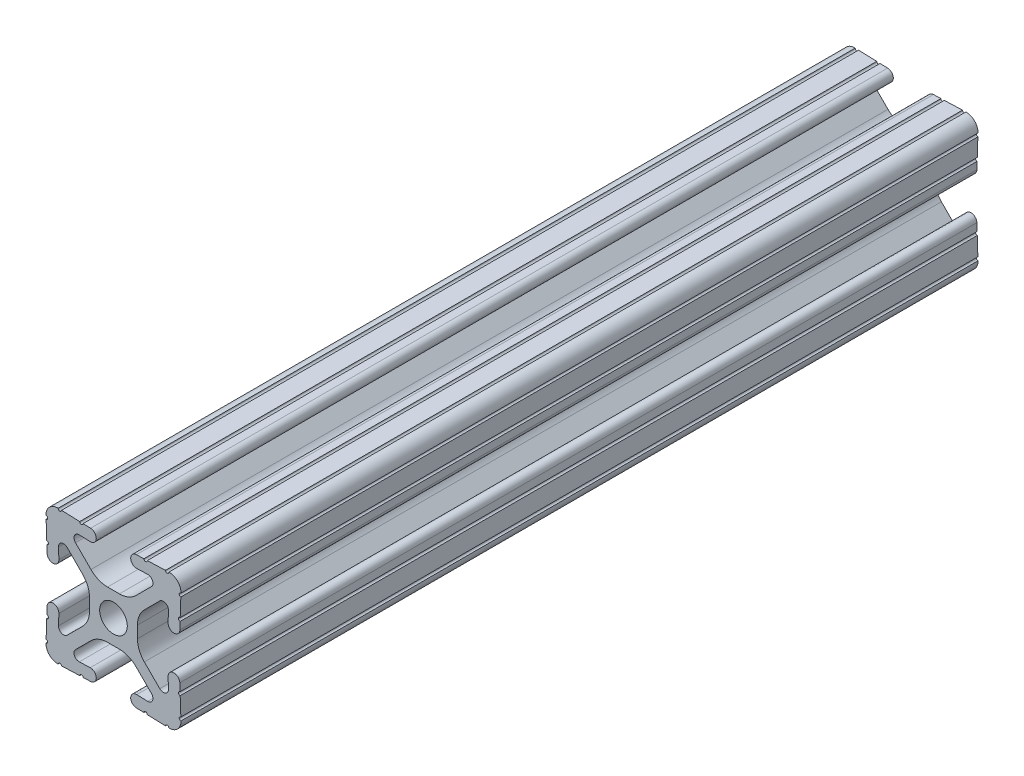
from build123d import *

# Parameters (mm, degrees)
SKETCH3_R      = 2.6035
EXTRUDE1_DEPTH = 75


with BuildPart() as part:
    # Sketch3 → Extrude1 (new, symmetric)
    with BuildSketch(Plane.XY):
        with BuildLine():
            Line((-1.115277175, 4.5085), (1.115277175, 4.5085))
            ThreePointArc((1.115277175, 4.5085), (2.806584872, 4.844922018), (4.240406305, 5.80297087))
            Line((4.240406305, 5.80297087), (7.148423664, 8.710988229))
            ThreePointArc((7.148423664, 8.710988229), (7.349906316, 9.772227925), (6.436353897, 10.348636575))
            Line((6.436353897, 10.348636575), (4.381960454, 10.276895575))
            ThreePointArc((4.381960454, 10.276895575), (3.239173075, 11.342562046), (4.304839546, 12.485349424))
            Line((4.304839546, 12.485349424), (5.728246175, 12.535055879))
            ThreePointArc((5.728246175, 12.535055879), (6.054756855, 12.230579745), (6.35923299, 12.557090424))
            Line((6.35923299, 12.557090424), (9.782092278, 12.676619304))
            ThreePointArc((9.782092278, 12.676619304), (10.108602958, 12.37214317), (10.413079092, 12.69865385))
            ThreePointArc((10.413079092, 12.69865385), (12.052764565, 12.052764565), (12.69865385, 10.413079092))
            ThreePointArc((12.69865385, 10.413079092), (12.37214317, 10.108602958), (12.676619304, 9.782092278))
            Line((12.676619304, 9.782092278), (12.557090424, 6.35923299))
            ThreePointArc((12.557090424, 6.35923299), (12.230579745, 6.054756855), (12.535055879, 5.728246175))
            Line((12.535055879, 5.728246175), (12.485349424, 4.304839546))
            ThreePointArc((12.485349424, 4.304839546), (11.342562046, 3.239173075), (10.276895575, 4.381960454))
            Line((10.276895575, 4.381960454), (10.348636575, 6.436353897))
            ThreePointArc((10.348636575, 6.436353897), (9.772227925, 7.349906316), (8.710988229, 7.148423664))
            Line((8.710988229, 7.148423664), (5.80297087, 4.240406305))
            ThreePointArc((5.80297087, 4.240406305), (4.844922018, 2.806584872), (4.5085, 1.115277175))
            Line((4.5085, 1.115277175), (4.5085, -1.115277175))
            ThreePointArc((4.5085, -1.115277175), (4.844922018, -2.806584872), (5.80297087, -4.240406305))
            Line((5.80297087, -4.240406305), (8.710988229, -7.148423664))
            ThreePointArc((8.710988229, -7.148423664), (9.772227925, -7.349906316), (10.348636575, -6.436353897))
            Line((10.348636575, -6.436353897), (10.276895575, -4.381960454))
            ThreePointArc((10.276895575, -4.381960454), (11.342562046, -3.239173075), (12.485349424, -4.304839546))
            Line((12.485349424, -4.304839546), (12.535055879, -5.728246175))
            ThreePointArc((12.535055879, -5.728246175), (12.230579745, -6.054756855), (12.557090424, -6.35923299))
            Line((12.557090424, -6.35923299), (12.676619304, -9.782092278))
            ThreePointArc((12.676619304, -9.782092278), (12.37214317, -10.108602958), (12.69865385, -10.413079092))
            ThreePointArc((12.69865385, -10.413079092), (12.052764565, -12.052764565), (10.413079092, -12.69865385))
            ThreePointArc((10.413079092, -12.69865385), (10.108602958, -12.37214317), (9.782092278, -12.676619304))
            Line((9.782092278, -12.676619304), (6.35923299, -12.557090424))
            ThreePointArc((6.35923299, -12.557090424), (6.054756855, -12.230579745), (5.728246175, -12.535055879))
            Line((5.728246175, -12.535055879), (4.304839546, -12.485349424))
            ThreePointArc((4.304839546, -12.485349424), (3.239173075, -11.342562046), (4.381960454, -10.276895575))
            Line((4.381960454, -10.276895575), (6.436353897, -10.348636575))
            ThreePointArc((6.436353897, -10.348636575), (7.349906316, -9.772227925), (7.148423664, -8.710988229))
            Line((7.148423664, -8.710988229), (4.240406305, -5.80297087))
            ThreePointArc((4.240406305, -5.80297087), (2.806584872, -4.844922018), (1.115277175, -4.5085))
            Line((1.115277175, -4.5085), (-1.115277175, -4.5085))
            ThreePointArc((-1.115277175, -4.5085), (-2.806584872, -4.844922018), (-4.240406305, -5.80297087))
            Line((-4.240406305, -5.80297087), (-7.148423664, -8.710988229))
            ThreePointArc((-7.148423664, -8.710988229), (-7.349906316, -9.772227925), (-6.436353897, -10.348636575))
            Line((-6.436353897, -10.348636575), (-4.381960454, -10.276895575))
            ThreePointArc((-4.381960454, -10.276895575), (-3.239173075, -11.342562046), (-4.304839546, -12.485349424))
            Line((-4.304839546, -12.485349424), (-5.728246175, -12.535055879))
            ThreePointArc((-5.728246175, -12.535055879), (-6.054756855, -12.230579745), (-6.35923299, -12.557090424))
            Line((-6.35923299, -12.557090424), (-9.782092278, -12.676619304))
            ThreePointArc((-9.782092278, -12.676619304), (-10.108602958, -12.37214317), (-10.413079092, -12.69865385))
            ThreePointArc((-10.413079092, -12.69865385), (-12.052764565, -12.052764565), (-12.69865385, -10.413079092))
            ThreePointArc((-12.69865385, -10.413079092), (-12.37214317, -10.108602958), (-12.676619304, -9.782092278))
            Line((-12.676619304, -9.782092278), (-12.557090424, -6.35923299))
            ThreePointArc((-12.557090424, -6.35923299), (-12.230579745, -6.054756855), (-12.535055879, -5.728246175))
            Line((-12.535055879, -5.728246175), (-12.485349424, -4.304839546))
            ThreePointArc((-12.485349424, -4.304839546), (-11.342562046, -3.239173075), (-10.276895575, -4.381960454))
            Line((-10.276895575, -4.381960454), (-10.348636575, -6.436353897))
            ThreePointArc((-10.348636575, -6.436353897), (-9.772227925, -7.349906316), (-8.710988229, -7.148423664))
            Line((-8.710988229, -7.148423664), (-5.80297087, -4.240406305))
            ThreePointArc((-5.80297087, -4.240406305), (-4.844922018, -2.806584872), (-4.5085, -1.115277175))
            Line((-4.5085, -1.115277175), (-4.5085, 1.115277175))
            ThreePointArc((-4.5085, 1.115277175), (-4.844922018, 2.806584872), (-5.80297087, 4.240406305))
            Line((-5.80297087, 4.240406305), (-8.710988229, 7.148423664))
            ThreePointArc((-8.710988229, 7.148423664), (-9.772227925, 7.349906316), (-10.348636575, 6.436353897))
            Line((-10.348636575, 6.436353897), (-10.276895575, 4.381960454))
            ThreePointArc((-10.276895575, 4.381960454), (-11.342562046, 3.239173075), (-12.485349424, 4.304839546))
            Line((-12.485349424, 4.304839546), (-12.535055879, 5.728246175))
            ThreePointArc((-12.535055879, 5.728246175), (-12.230579745, 6.054756855), (-12.557090424, 6.35923299))
            Line((-12.557090424, 6.35923299), (-12.676619304, 9.782092278))
            ThreePointArc((-12.676619304, 9.782092278), (-12.37214317, 10.108602958), (-12.69865385, 10.413079092))
            ThreePointArc((-12.69865385, 10.413079092), (-12.052764565, 12.052764565), (-10.413079092, 12.69865385))
            ThreePointArc((-10.413079092, 12.69865385), (-10.108602958, 12.37214317), (-9.782092278, 12.676619304))
            Line((-9.782092278, 12.676619304), (-6.35923299, 12.557090424))
            ThreePointArc((-6.35923299, 12.557090424), (-6.054756855, 12.230579745), (-5.728246175, 12.535055879))
            Line((-5.728246175, 12.535055879), (-4.304839546, 12.485349424))
            ThreePointArc((-4.304839546, 12.485349424), (-3.239173075, 11.342562046), (-4.381960454, 10.276895575))
            Line((-4.381960454, 10.276895575), (-6.436353897, 10.348636575))
            ThreePointArc((-6.436353897, 10.348636575), (-7.349906316, 9.772227925), (-7.148423664, 8.710988229))
            Line((-7.148423664, 8.710988229), (-4.240406305, 5.80297087))
            ThreePointArc((-4.240406305, 5.80297087), (-2.806584872, 4.844922018), (-1.115277175, 4.5085))
        make_face()
        Circle(SKETCH3_R, mode=Mode.SUBTRACT)
    extrude(amount=EXTRUDE1_DEPTH, both=True)


solid = part.part
